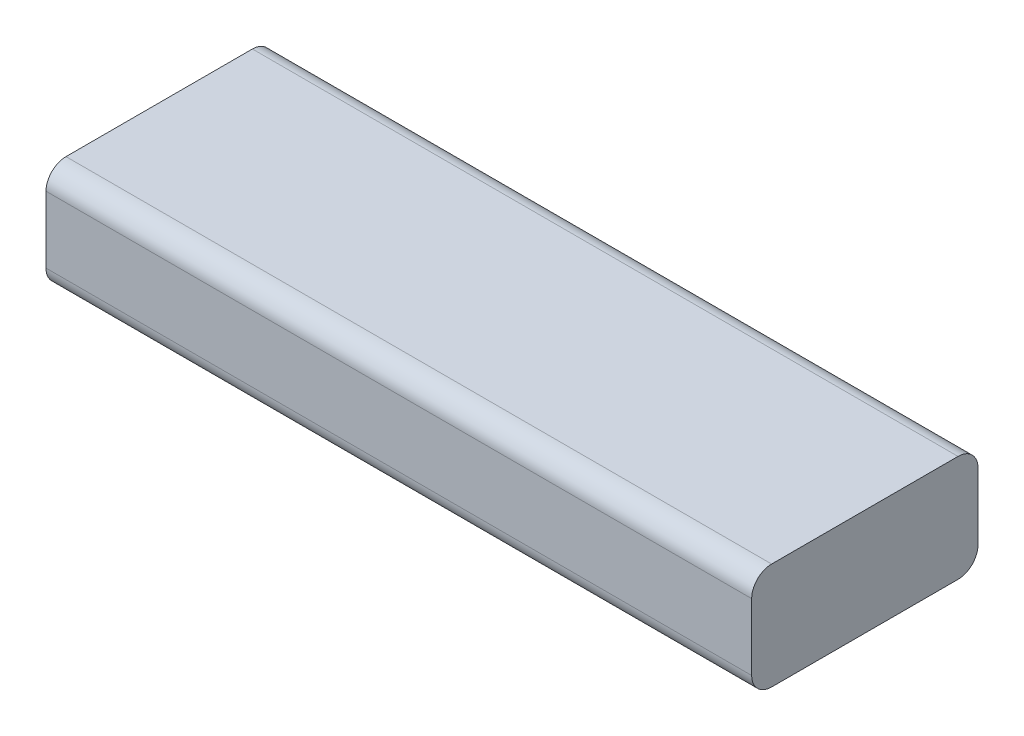
from build123d import *

# Parameters (mm, degrees)
SKETCH1_W           = 106
SKETCH1_H           = 34
BOSS_EXTRUDE1_DEPTH = 16
FILLET2_R           = 3


with BuildPart() as part:
    # Sketch1 → Boss-Extrude1 (new body)
    with BuildSketch(Plane(origin=(0, 0, 0), x_dir=(1, 0, 0), z_dir=(0, 1, 0))):
        with Locations((53, 17)):
            Rectangle(SKETCH1_W, SKETCH1_H)
    extrude(amount=BOSS_EXTRUDE1_DEPTH)

    # Fillet2
    fillet2_edges = [part.edges().sort_by_distance(p)[0] for p in [
        (53, 16, -34),
        (53, 0, -34),
        (53, 0, 0),
        (53, 16, 0),
    ]]
    fillet(fillet2_edges, radius=FILLET2_R)


solid = part.part
